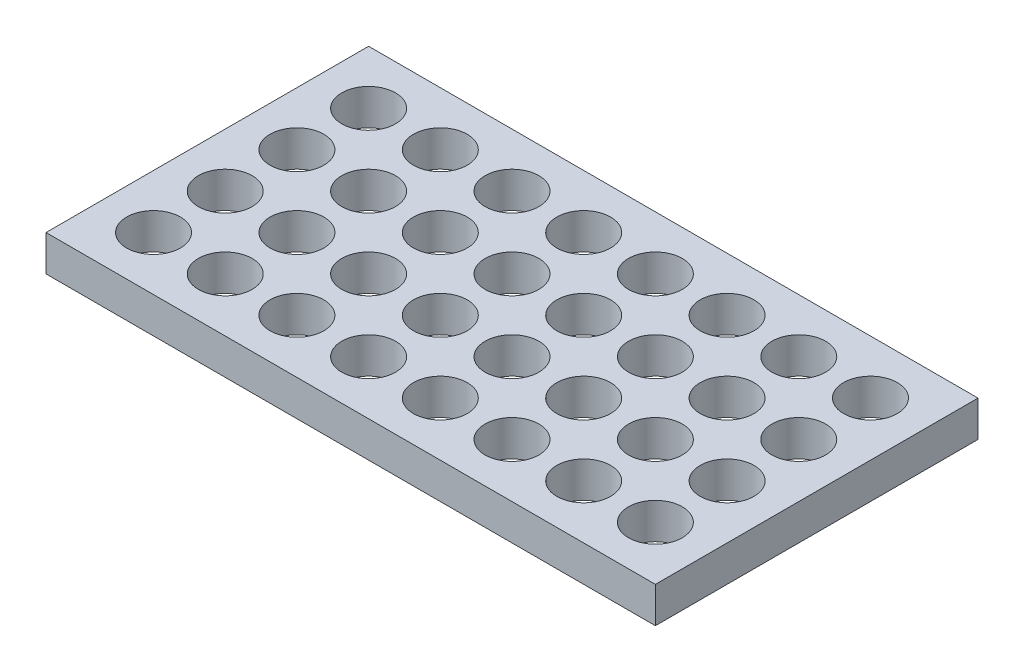
from build123d import *

# Parameters (mm, degrees)
SKETCH1_W           = 68
SKETCH1_H           = 36
SKETCH1_R           = 3
BOSS_EXTRUDE1_DEPTH = 4


with BuildPart() as part:
    # Sketch1 → Boss-Extrude1 (new body)
    with BuildSketch(Plane(origin=(0, 0, 0), x_dir=(1, 0, 0), z_dir=(0, 1, 0))):
        with Locations((34, 18)):
            Rectangle(SKETCH1_W, SKETCH1_H)
        with Locations(Location((6, 6, 0), (0, 0, 270))):
            Circle(SKETCH1_R, mode=Mode.SUBTRACT)
        with Locations(Location((14, 6, 0), (0, 0, 270))):
            Circle(SKETCH1_R, mode=Mode.SUBTRACT)
        with Locations(Location((22, 6, 0), (0, 0, 270))):
            Circle(SKETCH1_R, mode=Mode.SUBTRACT)
        with Locations(Location((30, 6, 0), (0, 0, 270))):
            Circle(SKETCH1_R, mode=Mode.SUBTRACT)
        with Locations(Location((38, 6, 0), (0, 0, 270))):
            Circle(SKETCH1_R, mode=Mode.SUBTRACT)
        with Locations(Location((46, 6, 0), (0, 0, 270))):
            Circle(SKETCH1_R, mode=Mode.SUBTRACT)
        with Locations(Location((54, 6, 0), (0, 0, 270))):
            Circle(SKETCH1_R, mode=Mode.SUBTRACT)
        with Locations(Location((62, 6, 0), (0, 0, 270))):
            Circle(SKETCH1_R, mode=Mode.SUBTRACT)
        with Locations(Location((14, 14, 0), (0, 0, 270))):
            Circle(SKETCH1_R, mode=Mode.SUBTRACT)
        with Locations(Location((22, 14, 0), (0, 0, 270))):
            Circle(SKETCH1_R, mode=Mode.SUBTRACT)
        with Locations(Location((30, 14, 0), (0, 0, 270))):
            Circle(SKETCH1_R, mode=Mode.SUBTRACT)
        with Locations(Location((38, 14, 0), (0, 0, 270))):
            Circle(SKETCH1_R, mode=Mode.SUBTRACT)
        with Locations(Location((46, 14, 0), (0, 0, 270))):
            Circle(SKETCH1_R, mode=Mode.SUBTRACT)
        with Locations(Location((54, 14, 0), (0, 0, 270))):
            Circle(SKETCH1_R, mode=Mode.SUBTRACT)
        with Locations(Location((62, 14, 0), (0, 0, 270))):
            Circle(SKETCH1_R, mode=Mode.SUBTRACT)
        with Locations(Location((14, 22, 0), (0, 0, 270))):
            Circle(SKETCH1_R, mode=Mode.SUBTRACT)
        with Locations(Location((22, 22, 0), (0, 0, 270))):
            Circle(SKETCH1_R, mode=Mode.SUBTRACT)
        with Locations(Location((30, 22, 0), (0, 0, 270))):
            Circle(SKETCH1_R, mode=Mode.SUBTRACT)
        with Locations(Location((38, 22, 0), (0, 0, 270))):
            Circle(SKETCH1_R, mode=Mode.SUBTRACT)
        with Locations(Location((46, 22, 0), (0, 0, 270))):
            Circle(SKETCH1_R, mode=Mode.SUBTRACT)
        with Locations(Location((54, 22, 0), (0, 0, 270))):
            Circle(SKETCH1_R, mode=Mode.SUBTRACT)
        with Locations(Location((62, 22, 0), (0, 0, 270))):
            Circle(SKETCH1_R, mode=Mode.SUBTRACT)
        with Locations(Location((14, 30, 0), (0, 0, 270))):
            Circle(SKETCH1_R, mode=Mode.SUBTRACT)
        with Locations(Location((22, 30, 0), (0, 0, 270))):
            Circle(SKETCH1_R, mode=Mode.SUBTRACT)
        with Locations(Location((30, 30, 0), (0, 0, 270))):
            Circle(SKETCH1_R, mode=Mode.SUBTRACT)
        with Locations(Location((38, 30, 0), (0, 0, 270))):
            Circle(SKETCH1_R, mode=Mode.SUBTRACT)
        with Locations(Location((46, 30, 0), (0, 0, 270))):
            Circle(SKETCH1_R, mode=Mode.SUBTRACT)
        with Locations(Location((54, 30, 0), (0, 0, 270))):
            Circle(SKETCH1_R, mode=Mode.SUBTRACT)
        with Locations(Location((62, 30, 0), (0, 0, 270))):
            Circle(SKETCH1_R, mode=Mode.SUBTRACT)
        with Locations(Location((6, 14, 0), (0, 0, 270))):
            Circle(SKETCH1_R, mode=Mode.SUBTRACT)
        with Locations(Location((6, 22, 0), (0, 0, 270))):
            Circle(SKETCH1_R, mode=Mode.SUBTRACT)
        with Locations(Location((6, 30, 0), (0, 0, 270))):
            Circle(SKETCH1_R, mode=Mode.SUBTRACT)
    extrude(amount=BOSS_EXTRUDE1_DEPTH)


solid = part.part
